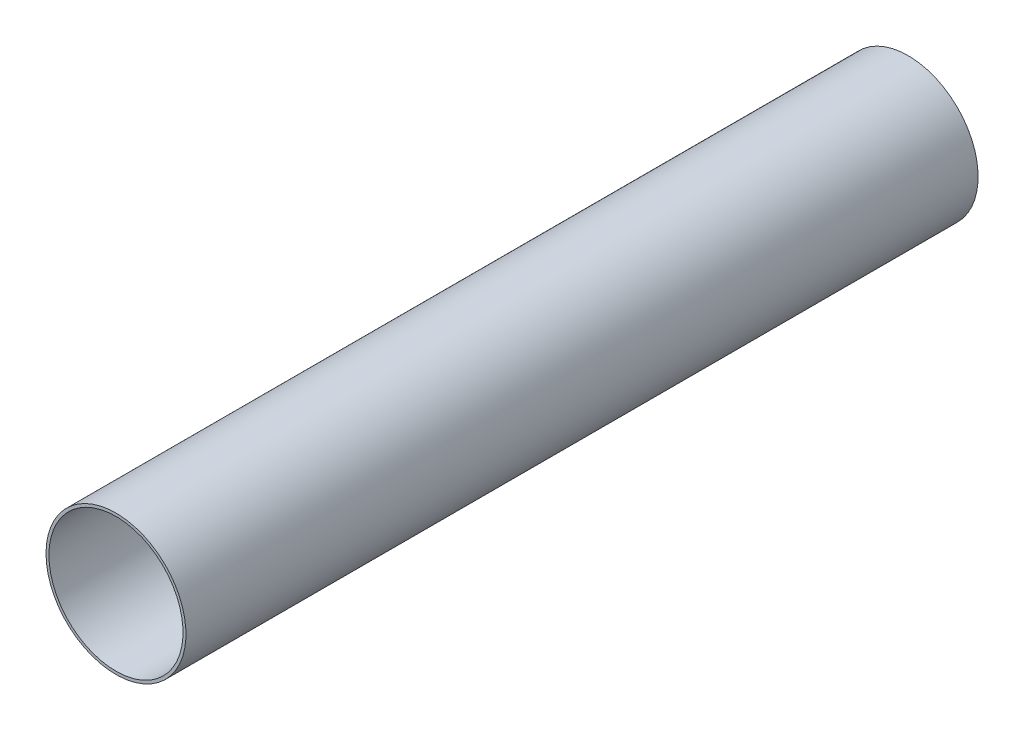
from build123d import *

# Parameters (mm, degrees)
SKETCH1_R           = 39.8145
SKETCH1_R_2         = 38.1635
BOSS_EXTRUDE1_DEPTH = 450.85


with BuildPart() as part:
    # Sketch1 → Boss-Extrude1 (new body)
    with BuildSketch(Plane.XY):
        with Locations(Location((0, 0, 0), (0, 0, 180))):
            Circle(SKETCH1_R)
        with Locations(Location((0, 0, 0), (0, 0, 180))):
            Circle(SKETCH1_R_2, mode=Mode.SUBTRACT)
    extrude(amount=BOSS_EXTRUDE1_DEPTH)


solid = part.part
